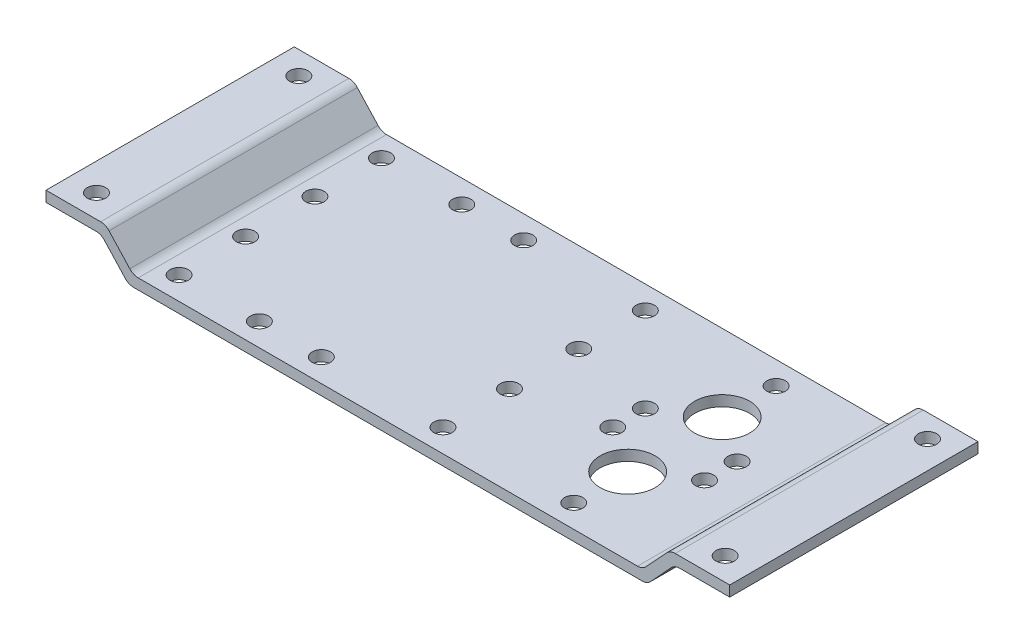
from build123d import *

# Parameters (mm, degrees)
BOSS_EXTRU_1_DEPTH      = 54.1
ESQUISSE2_R             = 2
ESQUISSE2_R_2           = 6
ENL_V_MAT_EXTRU_1_DEPTH = 159.761613748


with BuildPart() as part:
    # Esquisse1 → Boss.-Extru.1 (new body)
    with BuildSketch(Plane.XY):
        with BuildLine():
            Line((0, 0), (11.905421921, 0))
            ThreePointArc((11.905421921, 0), (12.908105659, -0.209885304), (13.742430532, -0.804299743))
            Line((13.742430532, -0.804299743), (18.257569468, -5.695700257))
            ThreePointArc((18.257569468, -5.695700257), (19.091894341, -6.290114696), (20.094578079, -6.5))
            Line((20.094578079, -6.5), (128.905421921, -6.5))
            ThreePointArc((128.905421921, -6.5), (129.908105659, -6.290114696), (130.742430532, -5.695700257))
            Line((130.742430532, -5.695700257), (135.257569468, -0.804299743))
            ThreePointArc((135.257569468, -0.804299743), (136.091894341, -0.209885304), (137.094578079, 0))
            Line((137.094578079, 0), (149, 0))
            Line((149, 0), (149, -2.3))
            Line((149, -2.3), (138.101589912, -2.3))
            ThreePointArc((138.101589912, -2.3), (137.098906174, -2.509885304), (136.264581301, -3.104299743))
            Line((136.264581301, -3.104299743), (131.749442365, -7.995700257))
            ThreePointArc((131.749442365, -7.995700257), (130.915117492, -8.590114696), (129.912433754, -8.8))
            Line((129.912433754, -8.8), (19.087566246, -8.8))
            ThreePointArc((19.087566246, -8.8), (18.084882508, -8.590114696), (17.250557635, -7.995700257))
            Line((17.250557635, -7.995700257), (12.735418699, -3.104299743))
            ThreePointArc((12.735418699, -3.104299743), (11.901093826, -2.509885304), (10.898410088, -2.3))
            Line((10.898410088, -2.3), (0, -2.3))
            Line((0, -2.3), (0, 0))
        make_face()
    extrude(amount=BOSS_EXTRU_1_DEPTH)

    # Esquisse2 → Enlèv. mat.-Extru.1 (cut, through all)
    with BuildSketch(Plane(origin=(0, 0, 0), x_dir=(1, 0, 0), z_dir=(0, 1, 0))):
        with Locations(Location((6, -5, 0), (0, 0, 270))):
            Circle(ESQUISSE2_R)
        with Locations(Location((24, -5, 0), (0, 0, 270))):
            Circle(ESQUISSE2_R)
        with Locations(Location((41.5, -5, 0), (0, 0, 270))):
            Circle(ESQUISSE2_R)
        with Locations(Location((55, -5, 0), (0, 0, 270))):
            Circle(ESQUISSE2_R)
        with Locations(Location((81.5, -5, 0), (0, 0, 270))):
            Circle(ESQUISSE2_R)
        with Locations(Location((110, -5, 0), (0, 0, 270))):
            Circle(ESQUISSE2_R)
        with Locations(Location((143, -5, 0), (0, 0, 270))):
            Circle(ESQUISSE2_R)
        with Locations(Location((120, -30.6, 0), (0, 0, 90))):
            Circle(ESQUISSE2_R)
        with Locations(Location((100, -30.6, 0), (0, 0, 90))):
            Circle(ESQUISSE2_R)
        with Locations(Location((110, -37.35, 0), (0, 0, 90))):
            Circle(ESQUISSE2_R_2)
        with Locations(Location((81.5, -34.6, 0), (0, 0, 90))):
            Circle(ESQUISSE2_R)
        with Locations(Location((24, -34.6, 0), (0, 0, 90))):
            Circle(ESQUISSE2_R)
        with Locations(Location((143, -49.1, 0), (0, 0, 270))):
            Circle(ESQUISSE2_R)
        with Locations(Location((110, -49.1, 0), (0, 0, 90))):
            Circle(ESQUISSE2_R)
        with Locations(Location((24, -19.5, 0), (0, 0, 270))):
            Circle(ESQUISSE2_R)
        with Locations(Location((81.5, -19.5, 0), (0, 0, 270))):
            Circle(ESQUISSE2_R)
        with Locations(Location((110, -16.75, 0), (0, 0, 270))):
            Circle(ESQUISSE2_R_2)
        with Locations(Location((120, -23.5, 0), (0, 0, 270))):
            Circle(ESQUISSE2_R)
        with Locations(Location((100, -23.5, 0), (0, 0, 270))):
            Circle(ESQUISSE2_R)
        with Locations(Location((81.5, -49.1, 0), (0, 0, 90))):
            Circle(ESQUISSE2_R)
        with Locations(Location((55, -49.1, 0), (0, 0, 90))):
            Circle(ESQUISSE2_R)
        with Locations(Location((41.5, -49.1, 0), (0, 0, 90))):
            Circle(ESQUISSE2_R)
        with Locations(Location((24, -49.1, 0), (0, 0, 90))):
            Circle(ESQUISSE2_R)
        with Locations(Location((6, -49.1, 0), (0, 0, 270))):
            Circle(ESQUISSE2_R)
    extrude(amount=-ENL_V_MAT_EXTRU_1_DEPTH, mode=Mode.SUBTRACT)


solid = part.part
